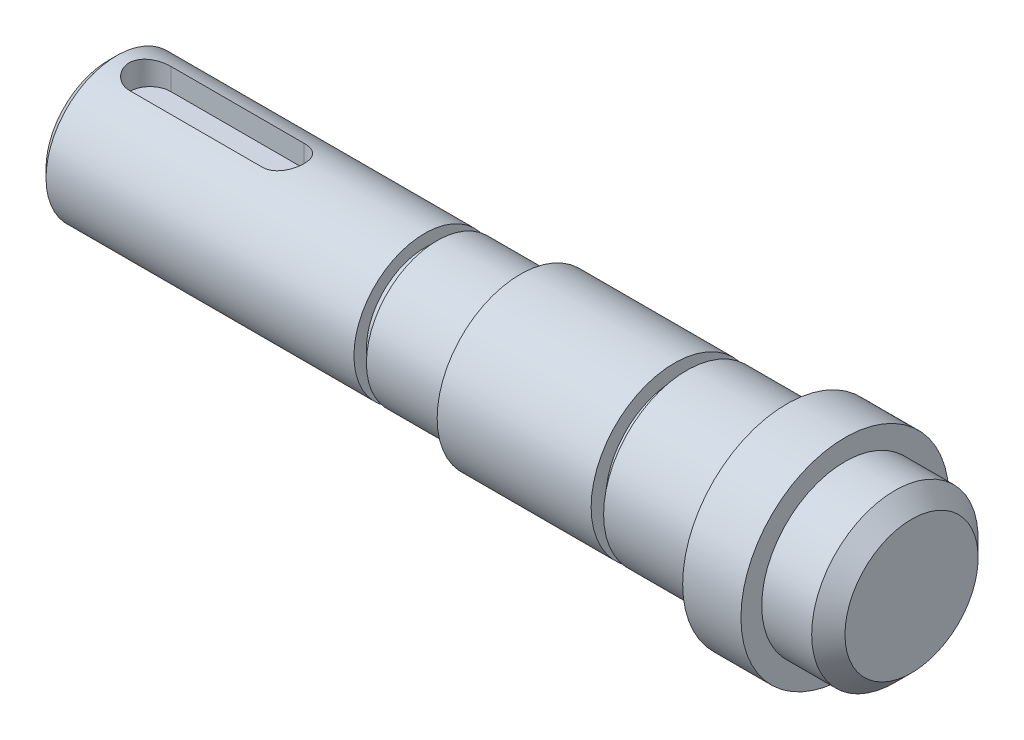
from build123d import *

# Parameters (mm, degrees)
ENL_V_MAT_EXTRU_1_DEPTH = 4.5


with BuildPart() as part:
    # Esquisse1 → Base-Révolution (revolve)
    with BuildSketch(Plane.XY, mode=Mode.PRIVATE) as base_r_volution_sk:
        Polygon((0, 0), (0, 7.5), (1, 8.5), (38, 8.5), (38, 7), (39.5, 7), (39.5, 8.5), (49.5, 8.5), (49.5, 10), (68, 10), (68, 8.25), (69.5, 8.25), (69.5, 10), (81.5, 10), (81.5, 12.5), (88.5, 12.5), (88.5, 10), (94.5, 10), (96.5, 8), (96.5, 0), align=None)
    revolve(base_r_volution_sk.sketch.rotate(Axis((0, 0, 0), (1, 0, 0)), 90), axis=Axis((0, 0, 0), (1, 0, 0)))

    # Esquisse2 → Enlèv. mat.-Extru.1 (cut)
    with BuildSketch(Plane(origin=(0, 10, 0), x_dir=(-1, 0, 0), z_dir=(0, 1, 0))):
        with BuildLine():
            Line((-21, 2.5), (-5, 2.5))
            ThreePointArc((-5, 2.5), (-2.5, 0), (-5, -2.5))
            Line((-5, -2.5), (-21, -2.5))
            ThreePointArc((-21, -2.5), (-23.5, 0), (-21, 2.5))
        make_face()
    extrude(amount=-ENL_V_MAT_EXTRU_1_DEPTH, mode=Mode.SUBTRACT)


solid = part.part
